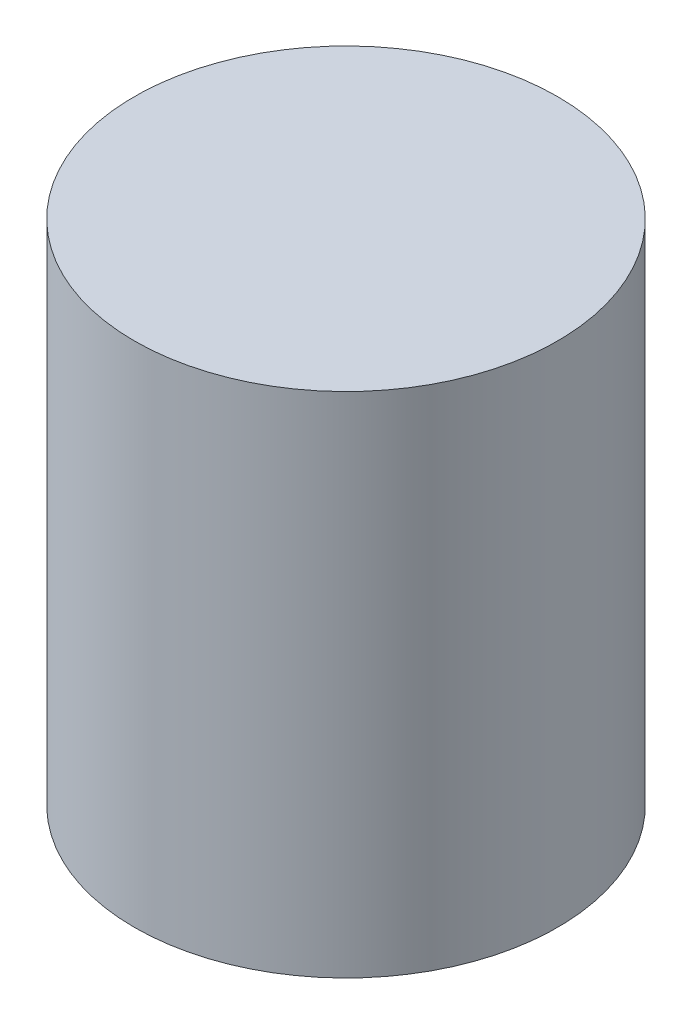
from build123d import *

# Parameters (mm, degrees)
SKETCH1_R           = 0.635
BOSS_EXTRUDE1_DEPTH = 1.524


with BuildPart() as part:
    # Sketch1 → Boss-Extrude1 (new body)
    with BuildSketch(Plane(origin=(0, 0, 0), x_dir=(1, 0, 0), z_dir=(0, 1, 0))):
        with Locations(Location((0, 0, 0), (0, 0, 270))):
            Circle(SKETCH1_R)
    extrude(amount=BOSS_EXTRUDE1_DEPTH)


solid = part.part
